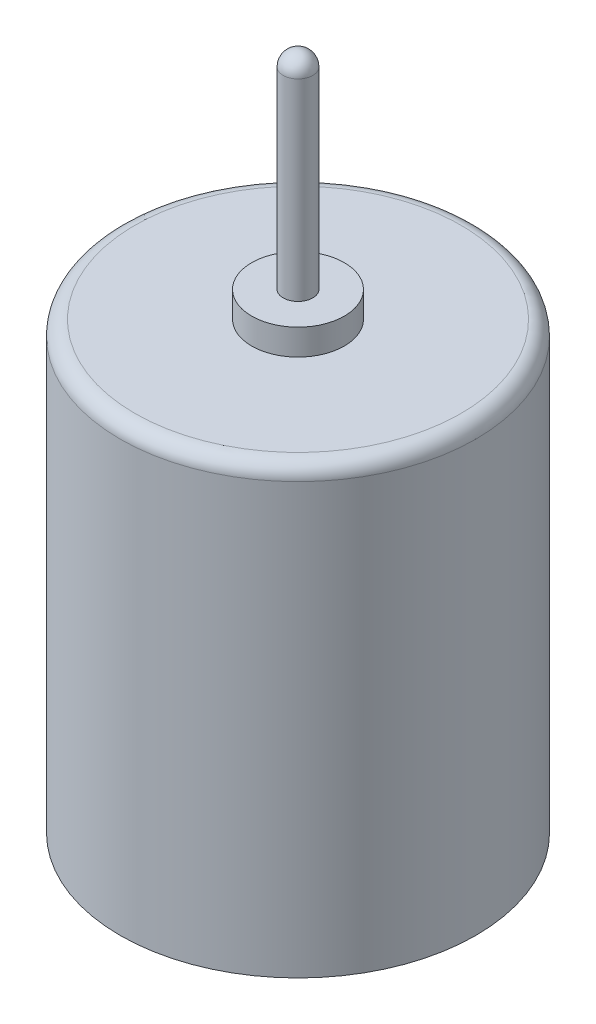
from build123d import *

# Parameters (mm, degrees)
SKETCH1_R           = 12.192
BOSS_EXTRUDE1_DEPTH = 30.48
SKETCH2_R           = 3.175
BOSS_EXTRUDE2_DEPTH = 1.778
SKETCH3_R           = 1.016
BOSS_EXTRUDE3_DEPTH = 14.224
FILLET1_R           = 1.016
FILLET2_R           = 1.016


with BuildPart() as part:
    # Sketch1 → Boss-Extrude1 (new body)
    with BuildSketch(Plane(origin=(0, 0, 0), x_dir=(1, 0, 0), z_dir=(0, 1, 0))):
        with Locations(Location((0, 0, 0), (0, 0, 90))):
            Circle(SKETCH1_R)
    extrude(amount=BOSS_EXTRUDE1_DEPTH)

    # Sketch2 → Boss-Extrude2 (add)
    with BuildSketch(Plane(origin=(0, 30.48, 0), x_dir=(1, 0, 0), z_dir=(0, 1, 0))):
        with Locations(Location((0, 0, 0), (0, 0, 270))):
            Circle(SKETCH2_R)
    extrude(amount=BOSS_EXTRUDE2_DEPTH)

    # Sketch3 → Boss-Extrude3 (add)
    with BuildSketch(Plane(origin=(0, 32.258, 0), x_dir=(1, 0, 0), z_dir=(0, 1, 0))):
        with Locations(Location((0, 0, 0), (0, 0, 270))):
            Circle(SKETCH3_R)
    extrude(amount=BOSS_EXTRUDE3_DEPTH)

    # Fillet1
    fillet1_edges = [part.edges().sort_by_distance(p)[0] for p in [
        (0, 46.482, -1.016),
    ]]
    fillet(fillet1_edges, radius=FILLET1_R)

    # Fillet2
    fillet2_edges = [part.edges().sort_by_distance(p)[0] for p in [
        (0, 30.48, 12.192),
    ]]
    fillet(fillet2_edges, radius=FILLET2_R)


solid = part.part
